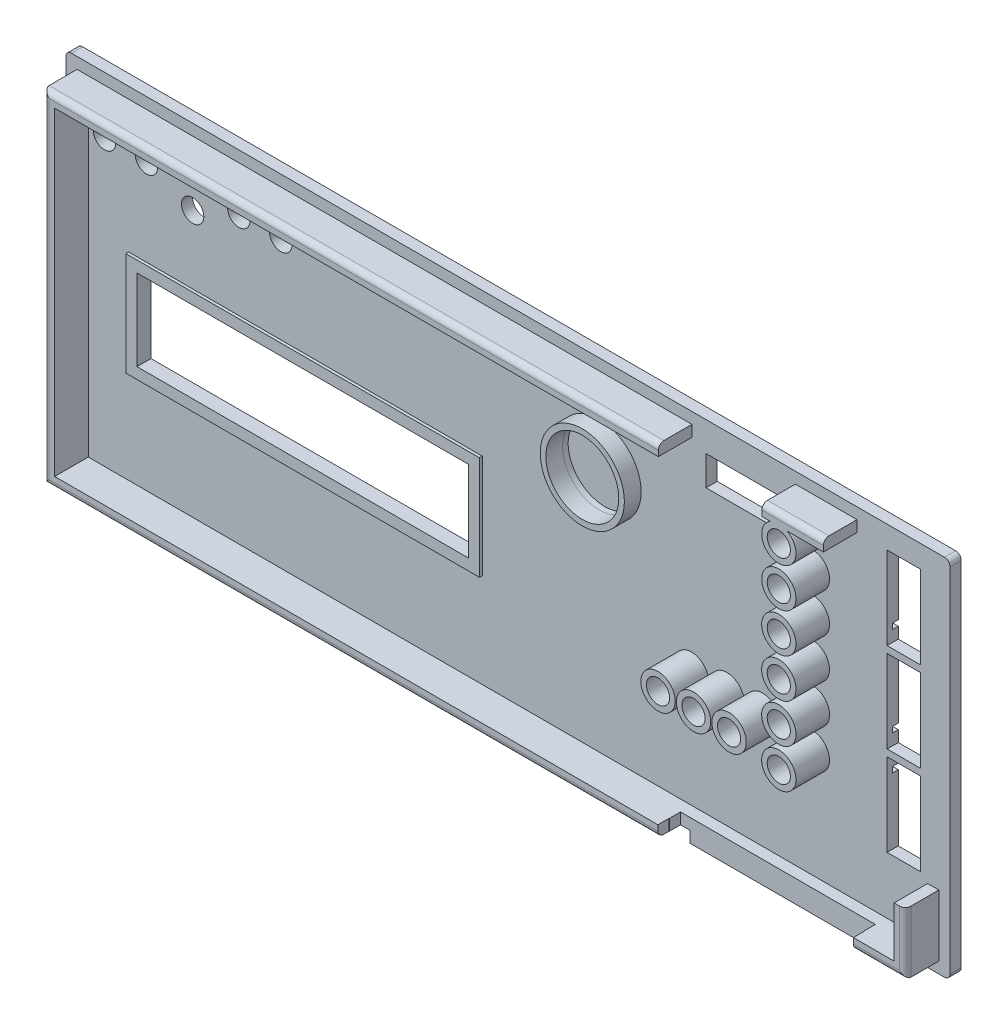
from build123d import *

# Parameters (mm, degrees)
ESBO_O1_W                 = 158
ESBO_O1_H                 = 65
RESSALTO_EXTRUS_O1_DEPTH  = 2
ESBO_O4_W                 = 154
ESBO_O4_H                 = 61
ESBO_O4_W_2               = 150
ESBO_O4_H_2               = 57
RESSALTO_EXTRUS_O3_DEPTH  = 6
ESBO_O5_W                 = 34.916260017
ESBO_O5_H                 = 2
CORTE_EXTRUS_O1_DEPTH     = 2
ESBO_O6_W                 = 6
ESBO_O6_H                 = 14.8
ESBO_O6_W_2               = 15
ESBO_O6_H_2               = 5.31
CORTE_EXTRUS_O2_DEPTH     = 4
FILETE2_R                 = 1
ESBO_O7_W                 = 59.2
ESBO_O7_H                 = 14.5
CORTE_EXTRUS_O3_DEPTH     = 2
ESBO_O8_W                 = 63.2
ESBO_O8_H                 = 18.5
ESBO_O8_W_2               = 59.2
ESBO_O8_H_2               = 14.5
RESSALTO_EXTRUS_O4_DEPTH  = 0.5
ESBO_O12_R                = 3.07
ESBO_O12_R_2              = 2.07
RESSALTO_EXTRUS_O7_DEPTH  = 6
CORTE_EXTRUS_O7_START     = -1.5
ESBO_O13_R                = 2.07
CORTE_EXTRUS_O7_DEPTH     = 1.5
FILETE8_R                 = 1
ESBO_O15_R                = 7.521612457
ESBO_O15_R_2              = 6.521612457
RESSALTO_EXTRUS_O15_DEPTH = 3
FILETE9_R                 = 1
ESBO_O18_W                = 14.910910572
ESBO_O18_H                = 50.333795371
ESBO_O18_W_2              = 34.830184523
ESBO_O18_H_2              = 10.122002382
ESBO_O18_W_3              = 18.503436418
ESBO_O18_H_3              = 13.97096752
CORTE_EXTRUS_O11_DEPTH    = 12
ESBO_O16_R                = 6.521612457
CORTE_EXTRUS_O12_DEPTH    = 1
ESBO_O9_R                 = 2
CORTE_EXTRUS_O13_DEPTH    = 4
ESBO_O19_W                = 34.830184523
ESBO_O19_H                = 2
RESSALTO_EXTRUS_O16_DEPTH = 2
CORTE_EXTRUS_O14_DEPTH    = 1
ESBO_O21_W                = 1
ESBO_O21_H                = 3
ESBO_O21_W_2              = 6
ESBO_O21_H_2              = 1
ESBO_O21_W_3              = 4
ESBO_O21_W_4              = 2
CORTE_EXTRUS_O15_DEPTH    = 1
CORTE_EXTRUS_O17_DEPTH    = 1
ESBO_O23_W                = 32
ESBO_O23_H                = 2
RESSALTO_EXTRUS_O17_DEPTH = 2


with BuildPart() as part:
    # Esboço1 → Ressalto-extrusão1 (new body)
    with BuildSketch(Plane.XY):
        with Locations((-79, 32.5)):
            Rectangle(ESBO_O1_W, ESBO_O1_H)
    extrude(amount=RESSALTO_EXTRUS_O1_DEPTH)

    # Esboço4 → Ressalto-extrusão3 (add)
    with BuildSketch(Plane.XY.offset(2)):
        with Locations((-79, 32.5)):
            Rectangle(ESBO_O4_W, ESBO_O4_H)
        with Locations((-79, 32.5)):
            Rectangle(ESBO_O4_W_2, ESBO_O4_H_2, mode=Mode.SUBTRACT)
    extrude(amount=RESSALTO_EXTRUS_O3_DEPTH)

    # Esboço5 → Corte-extrusão1 (cut)
    with BuildSketch(Plane.XY.offset(8)):
        with Locations((-28.742357263, 3)):
            Rectangle(ESBO_O5_W, ESBO_O5_H)
    extrude(amount=-CORTE_EXTRUS_O1_DEPTH, mode=Mode.SUBTRACT)

    # Esboço6 → Corte-extrusão2 (cut)
    with BuildSketch(Plane(origin=(0, 0, 0), x_dir=(-1, 0, 0), z_dir=(0, 0, -1))):
        with Locations((8.25, 53.6)):
            Rectangle(ESBO_O6_W, ESBO_O6_H)
        with Locations((36.108175154, 57.095)):
            Rectangle(ESBO_O6_W_2, ESBO_O6_H_2)
        with Locations((8.25, 37.6)):
            Rectangle(ESBO_O6_W, ESBO_O6_H)
        with Locations((8.25, 21.6)):
            Rectangle(ESBO_O6_W, ESBO_O6_H)
    extrude(amount=-CORTE_EXTRUS_O2_DEPTH, mode=Mode.SUBTRACT)

    # Filete2
    filete2_edges = [part.edges().sort_by_distance(p)[0] for p in [
        (0, 0, 1),
        (-158, 0, 1),
        (-158, 65, 1),
        (0, 65, 1),
    ]]
    fillet(filete2_edges, radius=FILETE2_R)

    # Esboço7 → Corte-extrusão3 (cut)
    with BuildSketch(Plane(origin=(0, 0, 0), x_dir=(-1, 0, 0), z_dir=(0, 0, -1))):
        with Locations((115.191824846, 30.1)):
            Rectangle(ESBO_O7_W, ESBO_O7_H)
    extrude(amount=-CORTE_EXTRUS_O3_DEPTH, mode=Mode.SUBTRACT)

    # Esboço8 → Ressalto-extrusão4 (add)
    with BuildSketch(Plane.XY.offset(2)):
        with Locations((-115.191824846, 30.1)):
            Rectangle(ESBO_O8_W, ESBO_O8_H)
        with Locations((-115.191824846, 30.1)):
            Rectangle(ESBO_O8_W_2, ESBO_O8_H_2, mode=Mode.SUBTRACT)
    extrude(amount=RESSALTO_EXTRUS_O4_DEPTH)

    # Esboço12 → Ressalto-extrusão7 (add)
    # profile 1 of 9: a face of its own
    with BuildSketch(Plane.XY.offset(2)):
        with Locations((-24.598175154, 37.32)):
            Circle(ESBO_O12_R)
        with Locations((-24.598175154, 37.32)):
            Circle(ESBO_O12_R_2, mode=Mode.SUBTRACT)
    # profile 2 of 9: a face of its own
    with BuildSketch(Plane.XY.offset(2)):
        with Locations((-24.598175154, 44.32)):
            Circle(ESBO_O12_R)
        with Locations((-24.598175154, 44.32)):
            Circle(ESBO_O12_R_2, mode=Mode.SUBTRACT)
    # profile 3 of 9: a face of its own
    with BuildSketch(Plane.XY.offset(2)):
        with Locations((-24.598175154, 51.32)):
            Circle(ESBO_O12_R)
        with Locations((-24.598175154, 51.32)):
            Circle(ESBO_O12_R_2, mode=Mode.SUBTRACT)
    # profile 4 of 9: a face of its own
    with BuildSketch(Plane.XY.offset(2)):
        with BuildLine():
            ThreePointArc((-26.095673067, 61), (-26.151813047, 55.672150062), (-21.528175154, 58.32))
            ThreePointArc((-21.528175154, 58.32), (-21.950325215, 59.873637893), (-23.100677241, 61))
            Line((-23.100677241, 61), (-26.095673067, 61))
        make_face()
        with Locations((-24.598175154, 58.32)):
            Circle(ESBO_O12_R_2, mode=Mode.SUBTRACT)
    # profile 5 of 9: a face of its own
    with BuildSketch(Plane.XY.offset(2)):
        with Locations((-24.598175154, 30.32)):
            Circle(ESBO_O12_R)
        with Locations((-24.598175154, 30.32)):
            Circle(ESBO_O12_R_2, mode=Mode.SUBTRACT)
    # profile 6 of 9: a face of its own
    with BuildSketch(Plane.XY.offset(2)):
        with Locations((-24.598175154, 23.32)):
            Circle(ESBO_O12_R)
        with Locations((-24.598175154, 23.32)):
            Circle(ESBO_O12_R_2, mode=Mode.SUBTRACT)
    # profile 7 of 9: a face of its own
    with BuildSketch(Plane.XY.offset(2)):
        with Locations((-33.488175154, 24.665)):
            Circle(ESBO_O12_R)
        with Locations((-33.488175154, 24.665)):
            Circle(ESBO_O12_R_2, mode=Mode.SUBTRACT)
    # profile 8 of 9: a face of its own
    with BuildSketch(Plane.XY.offset(2)):
        with Locations((-39.838175154, 24.665)):
            Circle(ESBO_O12_R)
        with Locations((-39.838175154, 24.665)):
            Circle(ESBO_O12_R_2, mode=Mode.SUBTRACT)
    # profile 9 of 9: a face of its own
    with BuildSketch(Plane.XY.offset(2)):
        with Locations((-46.188175154, 24.665)):
            Circle(ESBO_O12_R)
        with Locations((-46.188175154, 24.665)):
            Circle(ESBO_O12_R_2, mode=Mode.SUBTRACT)
    extrude(amount=RESSALTO_EXTRUS_O7_DEPTH)

    # Esboço13 → Corte-extrusão7 (cut)
    with BuildSketch(Plane.XY.offset(2).offset(CORTE_EXTRUS_O7_START)):
        with Locations((-24.598175154, 58.32)):
            Circle(ESBO_O13_R)
        with Locations((-24.598175154, 51.32)):
            Circle(ESBO_O13_R)
        with Locations((-24.598175154, 44.32)):
            Circle(ESBO_O13_R)
        with Locations((-24.598175154, 37.32)):
            Circle(ESBO_O13_R)
        with Locations((-24.598175154, 30.32)):
            Circle(ESBO_O13_R)
        with Locations((-24.598175154, 23.32)):
            Circle(ESBO_O13_R)
        with Locations((-33.488175154, 24.665)):
            Circle(ESBO_O13_R)
        with Locations((-39.838175154, 24.665)):
            Circle(ESBO_O13_R)
        with Locations((-46.188175154, 24.665)):
            Circle(ESBO_O13_R)
    extrude(amount=CORTE_EXTRUS_O7_DEPTH, mode=Mode.SUBTRACT)

    # Filete8
    filete8_edges = [part.edges().sort_by_distance(p)[0] for p in [
        (-26.668175154, 58.32, 0.5),
        (-26.668175154, 51.32, 0.5),
        (-26.668175154, 44.32, 0.5),
        (-26.668175154, 37.32, 0.5),
        (-26.668175154, 30.32, 0.5),
        (-26.668175154, 23.32, 0.5),
        (-35.558175154, 24.665, 0.5),
        (-41.908175154, 24.665, 0.5),
        (-48.258175154, 24.665, 0.5),
    ]]
    fillet(filete8_edges, radius=FILETE8_R)

    # Filete9
    filete9_edges = [part.edges().sort_by_distance(p)[0] for p in [
        (-156, 32.5, 8),
        (-101.100243635, 2, 8),
        (-2, 32.5, 8),
        (-79, 63, 8),
        (-6.642113627, 2, 8),
    ]]
    fillet(filete9_edges, radius=FILETE9_R)

    # Esboço18 → Corte-extrusão11 (cut)
    with BuildSketch(Plane.XY.offset(2)):
        with Locations((-9.173397854, 38.167539289)):
            Rectangle(ESBO_O18_W, ESBO_O18_H)
        with Locations((-28.756374545, 6.239060213)):
            Rectangle(ESBO_O18_W_2, ESBO_O18_H_2)
        with Locations((-36.873075077, 57.771374857)):
            Rectangle(ESBO_O18_W_3, ESBO_O18_H_3)
    extrude(amount=CORTE_EXTRUS_O11_DEPTH, mode=Mode.SUBTRACT)

    # Esboço16 → Corte-extrusão12 (cut)
    with BuildSketch(Plane.XY.offset(2)):
        with Locations((-62.716797966, 48.006994333)):
            Circle(ESBO_O16_R)
    extrude(amount=-CORTE_EXTRUS_O12_DEPTH, mode=Mode.SUBTRACT)

    # Esboço9 → Corte-extrusão13 (cut)
    with BuildSketch(Plane.XY.offset(2)):
        with Locations((-119.6, 55)):
            Circle(ESBO_O9_R)
        with Locations((-127.1, 55)):
            Circle(ESBO_O9_R)
        with Locations((-135.35, 58.5)):
            Circle(ESBO_O9_R)
        with Locations((-143.6, 55)):
            Circle(ESBO_O9_R)
        with Locations((-135.35, 51.5)):
            Circle(ESBO_O9_R)
        with Locations((-151.1, 55)):
            Circle(ESBO_O9_R)
    extrude(amount=-CORTE_EXTRUS_O13_DEPTH, mode=Mode.SUBTRACT)

    # Esboço19 → Ressalto-extrusão16 (add)
    with BuildSketch(Plane.XY.offset(2)):
        with Locations((-28.756374545, 3)):
            Rectangle(ESBO_O19_W, ESBO_O19_H)
    extrude(amount=RESSALTO_EXTRUS_O16_DEPTH)

    # Esboço20 → Corte-extrusão14 (cut)
    with BuildSketch(Plane(origin=(0, 0, 0), x_dir=(-1, 0, 0), z_dir=(0, 0, -1))):
        Polygon((17.192645985, 33.2), (11.25, 33.2), (11.25, 32.2), (18.192645985, 32.2), (18.192645985, 43), (15.982995463, 43), (13.118769012, 41.469097722), (13.590151702, 40.587168949), (16.233473959, 42), (17.192645985, 42), (17.192645985, 38.1), (15.982995463, 38.1), (13.118769012, 36.569097722), (13.590151702, 35.687168949), (16.233473959, 37.1), (17.192645985, 37.1), align=None)
        Polygon((17.190416657, 49.2), (11.247770672, 49.2), (11.247770672, 48.2), (18.190416657, 48.2), (18.190416657, 59), (15.980766134, 59), (13.116539684, 57.469097722), (13.587922373, 56.587168949), (16.231244631, 58), (17.190416657, 58), (17.190416657, 54.1), (15.980766134, 54.1), (13.116539684, 52.569097722), (13.587922373, 51.687168949), (16.231244631, 53.1), (17.190416657, 53.1), align=None)
        Polygon((16.234378597, 16.2), (18.193550623, 16.2), (18.193550623, 27), (11.25, 27), (11.25, 26), (17.193550623, 26), (17.193550623, 22.1), (15.9839001, 22.1), (13.11967365, 20.569097722), (13.591056339, 19.687168949), (16.234378597, 21.1), (17.193550623, 21.1), (17.193550623, 17.2), (15.9839001, 17.2), (13.11967365, 15.669097722), (13.591056339, 14.787168949), align=None)
    extrude(amount=-CORTE_EXTRUS_O14_DEPTH, mode=Mode.SUBTRACT)

    # Esboço21 → Corte-extrusão15 (cut)
    with BuildSketch(Plane(origin=(0, 0, 0), x_dir=(-1, 0, 0), z_dir=(0, 0, -1))):
        with Locations((31.608175154, 46.94)):
            Rectangle(ESBO_O21_W, ESBO_O21_H)
        with Locations((31.608175154, 48.94)):
            Rectangle(ESBO_O21_W_2, ESBO_O21_H_2)
        with Locations((31.608175154, 50.94)):
            Rectangle(ESBO_O21_W_3, ESBO_O21_H_2)
        with Locations((31.608175154, 52.94)):
            Rectangle(ESBO_O21_W_4, ESBO_O21_H_2)
    extrude(amount=-CORTE_EXTRUS_O15_DEPTH, mode=Mode.SUBTRACT)

    # Esboço22 → Corte-extrusão17 (cut)
    # profile 1 of 2: a face of its own
    with BuildSketch(Plane(origin=(0, 0, 0), x_dir=(-1, 0, 0), z_dir=(0, 0, -1))):
        with BuildLine():
            add(Edge.make_bspline(
                [(41.574921949, 51.456465608), (41.538213596, 51.482684405), (41.465552723, 51.53458215), (41.369836648, 51.627534684), (41.2868556, 51.730889173), (41.217804275, 51.844309806), (41.162639714, 51.965703133), (41.124729393, 52.093435847), (41.09937889, 52.225531667), (41.096705899, 52.315454609), (41.095354641, 52.360912723)],
                knots=[0, 0, 0, 0, 1.013470425, 2.00607327, 2.989559212, 3.987547927, 4.985093546, 5.979490292, 6.978585884, 8, 8, 8, 8], degree=3))
            add(Edge.make_bspline(
                [(41.095354641, 52.360912723), (41.097013989, 52.410128447), (41.100305093, 52.507741519), (41.129474986, 52.650873697), (41.176062092, 52.788252131), (41.240329815, 52.918253472), (41.320537038, 53.037296284), (41.413478028, 53.143525885), (41.520540131, 53.232254823), (41.61941604, 53.293315761), (41.705115825, 53.332930057), (41.773717664, 53.359974425), (41.847338802, 53.381291955), (41.924750988, 53.399627287), (42.006761955, 53.41337399), (42.092564327, 53.424195345), (42.182962513, 53.429443239), (42.244488257, 53.430356293), (42.276043743, 53.430824582)],
                knots=[0, 0, 0, 0, 1.313633616, 2.605423678, 3.884827599, 5.180399172, 6.467003699, 7.709825993, 8.937691468, 10.168030689, 10.802071053, 11.45831639, 12.135866991, 12.84764728, 13.582572811, 14.35620613, 15.156926628, 16, 16, 16, 16], degree=3))
            add(Edge.make_bspline(
                [(42.276043743, 53.430824582), (42.309703107, 53.430365424), (42.375433207, 53.42946878), (42.471394721, 53.424113292), (42.561877166, 53.41404915), (42.647290527, 53.401386983), (42.726851504, 53.382584097), (42.801617067, 53.362142537), (42.870778455, 53.336748422), (42.955319703, 53.297581954), (43.05331542, 53.239007173), (43.157902304, 53.151435841), (43.251089596, 53.048759251), (43.329135736, 52.930242049), (43.394169034, 52.800922346), (43.440581358, 52.661450255), (43.468536397, 52.513709334), (43.471865383, 52.412451096), (43.473559769, 52.360912723)],
                knots=[0, 0, 0, 0, 0.887187828, 1.732502891, 2.531768656, 3.28622382, 4.00645991, 4.68503301, 5.328123524, 5.945476897, 7.13918604, 8.324554323, 9.528234031, 10.780485522, 12.053158567, 13.332907357, 14.642504384, 16, 16, 16, 16], degree=3))
            add(Edge.make_bspline(
                [(43.473559769, 52.360912723), (43.472403682, 52.315933613), (43.470130493, 52.227492201), (43.446487041, 52.098407369), (43.410439196, 51.974945784), (43.357755075, 51.858243904), (43.291610674, 51.746889574), (43.209222335, 51.643167575), (43.113401646, 51.54453881), (43.04048174, 51.486310306), (43.003107045, 51.456465608)],
                knots=[0, 0, 0, 0, 1.017680362, 2.001042016, 2.962316111, 3.924347734, 4.892953533, 5.888308623, 6.917664266, 8, 8, 8, 8], degree=3))
            add(Edge.make_bspline(
                [(43.003107045, 51.456465608), (43.026278555, 51.429755152), (43.07189628, 51.377170308), (43.130773057, 51.292469119), (43.181016585, 51.205311514), (43.221559293, 51.115181968), (43.254155828, 51.02311952), (43.277603049, 50.928557604), (43.290937213, 50.831212848), (43.293020382, 50.765432431), (43.29407259, 50.732206794)],
                knots=[0, 0, 0, 0, 1.06167017, 2.090108827, 3.093337593, 4.079993162, 5.054811602, 6.023746282, 7.001795783, 8, 8, 8, 8], degree=3))
            add(Edge.make_bspline(
                [(43.29407259, 50.732206794), (43.292688417, 50.687225722), (43.289957497, 50.5984798), (43.265323505, 50.468581253), (43.225335229, 50.344720826), (43.168922008, 50.228527417), (43.099500707, 50.121097167), (43.015458264, 50.026128498), (42.919272599, 49.943142824), (42.810378057, 49.873858919), (42.690694894, 49.819110369), (42.561537839, 49.779755511), (42.423502764, 49.755323668), (42.328263796, 49.752686372), (42.279549352, 49.751337403)],
                knots=[0, 0, 0, 0, 1.022461855, 2.017277858, 2.995792987, 3.975491763, 4.947267477, 5.896545572, 6.850353789, 7.828175386, 8.82259352, 9.83498435, 10.892601059, 12, 12, 12, 12], degree=3))
            add(Edge.make_bspline(
                [(42.279549352, 49.751337403), (42.231536242, 49.752684654), (42.137920728, 49.755311513), (42.002098598, 49.779674519), (41.875321519, 49.819863383), (41.757763757, 49.875335433), (41.650384232, 49.9454247), (41.555905856, 50.030922305), (41.472205996, 50.128378756), (41.401991155, 50.238350503), (41.345488515, 50.356836217), (41.304213196, 50.481328461), (41.280006886, 50.610441626), (41.276570394, 50.697986819), (41.27484182, 50.742022499)],
                knots=[0, 0, 0, 0, 1.094374825, 2.133801765, 3.135215957, 4.120034135, 5.089936793, 6.048819145, 7.016727444, 8.011879177, 9.015716645, 10.003559944, 10.995780443, 12, 12, 12, 12], degree=3))
            add(Edge.make_bspline(
                [(41.27484182, 50.742022499), (41.275679727, 50.773141871), (41.277324057, 50.834211313), (41.289437341, 50.924197029), (41.309953453, 51.010487325), (41.338169373, 51.095506422), (41.379032957, 51.180382496), (41.431269781, 51.269214141), (41.497695413, 51.362176814), (41.548369032, 51.424046149), (41.574921949, 51.456465608)],
                knots=[0, 0, 0, 0, 0.940860718, 1.84636882, 2.739437118, 3.619946589, 4.54937856, 5.582024627, 6.73298378, 8, 8, 8, 8], degree=3))
        make_face()
        with BuildLine():
            add(Edge.make_bspline(
                [(42.294974032, 50.379542531), (42.320833365, 50.380812576), (42.371359819, 50.383294114), (42.443119596, 50.404917739), (42.507751067, 50.440352247), (42.563539153, 50.48955719), (42.608865426, 50.549909921), (42.642753753, 50.618701962), (42.662658464, 50.695580261), (42.664776995, 50.749384213), (42.665867461, 50.777078588)],
                knots=[0, 0, 0, 0, 1.017635784, 1.98835473, 2.924394675, 3.903775679, 4.896969949, 5.881752986, 6.909679918, 8, 8, 8, 8], degree=3))
            add(Edge.make_bspline(
                [(42.665867461, 50.777078588), (42.664507914, 50.805004973), (42.661853267, 50.859533931), (42.64143701, 50.938054585), (42.605355259, 51.00876178), (42.556957141, 51.070672949), (42.499650335, 51.122960847), (42.433153121, 51.16010326), (42.360372204, 51.183858026), (42.309182759, 51.186093713), (42.283054961, 51.187234838)],
                knots=[0, 0, 0, 0, 1.071109905, 2.091445327, 3.086230388, 4.096303754, 5.093673306, 6.041538876, 7.0003745, 8, 8, 8, 8], degree=3))
            add(Edge.make_bspline(
                [(42.283054961, 51.187234838), (42.256490726, 51.186024806), (42.204738613, 51.183667436), (42.130854145, 51.16121371), (42.064986031, 51.123637018), (42.007488065, 51.07323157), (41.960925191, 51.010801867), (41.926738535, 50.938964586), (41.907048134, 50.858034289), (41.9044133, 50.801491987), (41.903046949, 50.772170736)],
                knots=[0, 0, 0, 0, 1.008985882, 1.965693801, 2.905634363, 3.876216071, 4.854591133, 5.849205062, 6.884658104, 8, 8, 8, 8], degree=3))
            add(Edge.make_bspline(
                [(41.903046949, 50.772170736), (41.904346317, 50.744460869), (41.906862073, 50.690810736), (41.92763301, 50.614435475), (41.961987921, 50.546235447), (42.009084799, 50.487055778), (42.067693667, 50.439094979), (42.135865492, 50.403866496), (42.212950462, 50.38342394), (42.267040766, 50.380864351), (42.294974032, 50.379542531)],
                knots=[0, 0, 0, 0, 1.066147256, 2.064208482, 3.022454516, 3.989792431, 4.955788801, 5.918128389, 6.924881755, 8, 8, 8, 8], degree=3))
        make_face(mode=Mode.SUBTRACT)
        with BuildLine():
            add(Edge.make_bspline(
                [(42.2746415, 51.815439967), (42.294298979, 51.815758984), (42.333043623, 51.816387764), (42.38996001, 51.823912238), (42.444802828, 51.834594329), (42.496611146, 51.851236828), (42.546757477, 51.870678382), (42.593975989, 51.896066444), (42.639075717, 51.925558021), (42.681083495, 51.959163238), (42.719060572, 51.996012271), (42.753290349, 52.034453655), (42.78126909, 52.075470201), (42.804568522, 52.117701274), (42.823289796, 52.161480823), (42.835665961, 52.207529991), (42.843634482, 52.255235483), (42.844777881, 52.287730531), (42.845354641, 52.304121858)],
                knots=[0, 0, 0, 0, 1.129662435, 2.226550525, 3.296682235, 4.33815786, 5.351414921, 6.385493299, 7.41431807, 8.4469981, 9.473537958, 10.454642902, 11.401552439, 12.321859429, 13.225429467, 14.131893492, 15.057679712, 16, 16, 16, 16], degree=3))
            add(Edge.make_bspline(
                [(42.845354641, 52.304121858), (42.845078457, 52.321215727), (42.84453068, 52.355119302), (42.836314637, 52.404615884), (42.824389731, 52.452307395), (42.807953164, 52.498058846), (42.784668495, 52.540944139), (42.758279585, 52.582637339), (42.726398022, 52.622006555), (42.690196786, 52.658799812), (42.650264896, 52.692681528), (42.60660811, 52.721969547), (42.560143693, 52.747645762), (42.510190294, 52.767854028), (42.457260089, 52.783189131), (42.401674049, 52.794293815), (42.34308267, 52.801697045), (42.302943714, 52.802306715), (42.28235384, 52.802619454)],
                knots=[0, 0, 0, 0, 0.974019005, 1.931846162, 2.853358636, 3.777086404, 4.695411081, 5.630991801, 6.588726176, 7.578582455, 8.572023234, 9.570371685, 10.572628972, 11.595075622, 12.6370648, 13.711634473, 14.826148828, 16, 16, 16, 16], degree=3))
            add(Edge.make_bspline(
                [(42.28235384, 52.802619454), (42.261536326, 52.802242113), (42.220969585, 52.801506794), (42.161669186, 52.795007944), (42.10558146, 52.784696218), (42.052773734, 52.769947848), (42.003045139, 52.751055286), (41.95706696, 52.727006311), (41.913774047, 52.699760884), (41.874613409, 52.667897757), (41.838935176, 52.633519128), (41.808634343, 52.595369015), (41.781389488, 52.555875296), (41.760890589, 52.512489268), (41.74333445, 52.467730645), (41.73289997, 52.419896101), (41.724227575, 52.370104931), (41.723785593, 52.335715212), (41.723559769, 52.318144294)],
                knots=[0, 0, 0, 0, 1.200730299, 2.339843079, 3.437336227, 4.487507367, 5.49914389, 6.500211663, 7.47645343, 8.445123332, 9.408146062, 10.328401978, 11.252108805, 12.168702489, 13.09034032, 14.019150537, 14.98791428, 16, 16, 16, 16], degree=3))
            add(Edge.make_bspline(
                [(41.723559769, 52.318144294), (41.724201538, 52.300598397), (41.725455974, 52.26630225), (41.732310393, 52.215651335), (41.745199312, 52.167651208), (41.761960494, 52.12110462), (41.784579276, 52.077400022), (41.811314566, 52.035199312), (41.843989472, 51.99631256), (41.880108323, 51.958984785), (41.920707011, 51.925584879), (41.964270292, 51.896291369), (42.009640701, 51.870513333), (42.05827749, 51.851264755), (42.108663116, 51.834586529), (42.162119818, 51.823912803), (42.217636022, 51.816386041), (42.255450664, 51.815758462), (42.2746415, 51.815439967)],
                knots=[0, 0, 0, 0, 1.011607766, 1.977342622, 2.937803287, 3.871057497, 4.822789971, 5.768019373, 6.744124207, 7.744188914, 8.758214762, 9.766859222, 10.76764927, 11.758144632, 12.776187854, 13.822267547, 14.894806271, 16, 16, 16, 16], degree=3))
        make_face(mode=Mode.SUBTRACT)
    # profile 2 of 2: a face of its own
    with BuildSketch(Plane(origin=(0, 0, 0), x_dir=(-1, 0, 0), z_dir=(0, 0, -1))):
        with BuildLine():
            Line((36.953127077, 53.430824582), (37.509817782, 53.150375864))
            Line((37.509817782, 53.150375864), (36.89984182, 51.950055351))
            add(Edge.make_bspline(
                [(36.89984182, 51.950055351), (36.935880545, 51.949136701), (37.006633282, 51.947333169), (37.110812111, 51.932347954), (37.210432157, 51.906761883), (37.306684965, 51.87271875), (37.398174998, 51.827011676), (37.486379594, 51.77264048), (37.568995663, 51.706317621), (37.648001815, 51.632881645), (37.719468933, 51.551492391), (37.782586355, 51.464529454), (37.836031691, 51.372829831), (37.878935358, 51.275777317), (37.912632082, 51.17433912), (37.937485251, 51.068117325), (37.951390297, 50.956703356), (37.953337652, 50.880881752), (37.954329, 50.842282915)],
                knots=[0, 0, 0, 0, 1.014438208, 1.991587644, 2.955575466, 3.906834206, 4.860343588, 5.829907848, 6.818577787, 7.838125475, 8.863876483, 9.862937823, 10.859547262, 11.846397878, 12.845242478, 13.865236027, 14.913246352, 16, 16, 16, 16], degree=3))
            add(Edge.make_bspline(
                [(37.954329, 50.842282915), (37.953411662, 50.804841275), (37.951604068, 50.731063296), (37.936552114, 50.622793089), (37.911878924, 50.518792226), (37.877616257, 50.4190931), (37.833264205, 50.323869334), (37.778498044, 50.23352098), (37.714789994, 50.147047873), (37.641322813, 50.066477099), (37.561800115, 49.992702424), (37.476796861, 49.928499764), (37.388507018, 49.873131347), (37.295038374, 49.829142617), (37.19809889, 49.79343497), (37.096405306, 49.769278876), (36.990983236, 49.754058739), (36.919292328, 49.752251773), (36.883014897, 49.751337403)],
                knots=[0, 0, 0, 0, 1.05547428, 2.079790231, 3.075662031, 4.065650429, 5.047466705, 6.031911617, 7.04026589, 8.071428158, 9.102169131, 10.094698886, 11.071325611, 12.035261792, 13.002593907, 13.979242867, 14.977445265, 16, 16, 16, 16], degree=3))
            add(Edge.make_bspline(
                [(36.883014897, 49.751337403), (36.845091081, 49.752118345), (36.770519028, 49.753653963), (36.661352062, 49.770587484), (36.556918956, 49.796590124), (36.456732075, 49.831823672), (36.362380761, 49.879894446), (36.272067234, 49.936366133), (36.187541815, 50.004751188), (36.108371144, 50.081685422), (36.037097099, 50.166078818), (35.973552257, 50.253688263), (35.919537098, 50.344783691), (35.8763899, 50.439428538), (35.842082086, 50.536972491), (35.818705526, 50.637631335), (35.803144923, 50.741306123), (35.801377394, 50.81160993), (35.800482846, 50.847190768)],
                knots=[0, 0, 0, 0, 1.062709067, 2.08967359, 3.089490552, 4.078335371, 5.060205664, 6.052952122, 7.060109841, 8.102908433, 9.144326257, 10.153805576, 11.135063239, 12.108674621, 13.066249871, 14.029571809, 15.002763993, 16, 16, 16, 16], degree=3))
            add(Edge.make_bspline(
                [(35.800482846, 50.847190768), (35.800974147, 50.874326821), (35.801963737, 50.928984934), (35.811572679, 51.010727587), (35.826352204, 51.092680267), (35.843588422, 51.161709846), (35.860925791, 51.220133556), (35.878953757, 51.269555785), (35.900696327, 51.324627851), (35.925862113, 51.385434507), (35.954653302, 51.451674524), (35.988051279, 51.523117702), (36.023946615, 51.600858777), (36.050409372, 51.654015505), (36.064104641, 51.681525704)],
                knots=[0, 0, 0, 0, 1.105166677, 2.22605417, 3.348517788, 4.496260522, 5.122810462, 5.830557215, 6.638607343, 7.535109037, 8.511576286, 9.580928918, 10.748058253, 12, 12, 12, 12], degree=3))
            Line((36.064104641, 51.681525704), (36.953127077, 53.430824582))
        make_face()
        with BuildLine():
            add(Edge.make_bspline(
                [(36.868992461, 51.366722018), (36.838888979, 51.364952708), (36.78007359, 51.361495878), (36.695631774, 51.334684351), (36.619756411, 51.288942564), (36.55320035, 51.227325072), (36.497795278, 51.1532492), (36.457197359, 51.069085451), (36.432583736, 50.976174204), (36.430011506, 50.911379834), (36.428687974, 50.878040127)],
                knots=[0, 0, 0, 0, 0.984989413, 1.924446292, 2.868477643, 3.865502828, 4.877610339, 5.88087679, 6.909612885, 8, 8, 8, 8], degree=3))
            add(Edge.make_bspline(
                [(36.428687974, 50.878040127), (36.430252758, 50.843994509), (36.433296635, 50.777767653), (36.458554932, 50.682688325), (36.500348408, 50.596200856), (36.558723414, 50.521238676), (36.627277626, 50.459018665), (36.703290516, 50.413002957), (36.78550057, 50.384734221), (36.842367062, 50.381285044), (36.871095827, 50.379542531)],
                knots=[0, 0, 0, 0, 1.10379546, 2.14714571, 3.168417875, 4.20176326, 5.211701457, 6.157576563, 7.069213742, 8, 8, 8, 8], degree=3))
            add(Edge.make_bspline(
                [(36.871095827, 50.379542531), (36.901459541, 50.381242162), (36.961078446, 50.384579375), (37.046651131, 50.41276905), (37.125178439, 50.457777066), (37.194794159, 50.519883714), (37.25364661, 50.594453108), (37.29549378, 50.680870422), (37.321722839, 50.775550642), (37.324630483, 50.841873057), (37.326123872, 50.875936761)],
                knots=[0, 0, 0, 0, 0.970853505, 1.906262912, 2.855477211, 3.852937491, 4.877462982, 5.878766514, 6.910518104, 8, 8, 8, 8], degree=3))
            add(Edge.make_bspline(
                [(37.326123872, 50.875936761), (37.324474029, 50.909491401), (37.321268185, 50.974692121), (37.297226508, 51.068701146), (37.254919089, 51.153162398), (37.198028694, 51.22761777), (37.129227038, 51.289221166), (37.05026847, 51.335043838), (36.962013374, 51.361439399), (36.900481614, 51.364933762), (36.868992461, 51.366722018)],
                knots=[0, 0, 0, 0, 1.075564157, 2.089951178, 3.085472164, 4.085356838, 5.078137244, 6.028240785, 6.99094342, 8, 8, 8, 8], degree=3))
        make_face(mode=Mode.SUBTRACT)
    extrude(amount=-CORTE_EXTRUS_O17_DEPTH, mode=Mode.SUBTRACT)

    # Esboço23 → Ressalto-extrusão17 (add)
    with BuildSketch(Plane(origin=(0, 2, 0), x_dir=(-1, 0, 0), z_dir=(0, -1, 0))):
        with Locations((28.5, -3)):
            Rectangle(ESBO_O23_W, ESBO_O23_H)
    extrude(amount=RESSALTO_EXTRUS_O17_DEPTH)


with BuildPart() as body_2:
    # Esboço15 → Ressalto-extrusão15 (new body)
    with BuildSketch(Plane.XY.offset(2)):
        with Locations((-62.716797966, 48.006994333)):
            Circle(ESBO_O15_R)
        with Locations((-62.716797966, 48.006994333)):
            Circle(ESBO_O15_R_2, mode=Mode.SUBTRACT)
    extrude(amount=RESSALTO_EXTRUS_O15_DEPTH)


solid = Compound([part.part, body_2.part])
